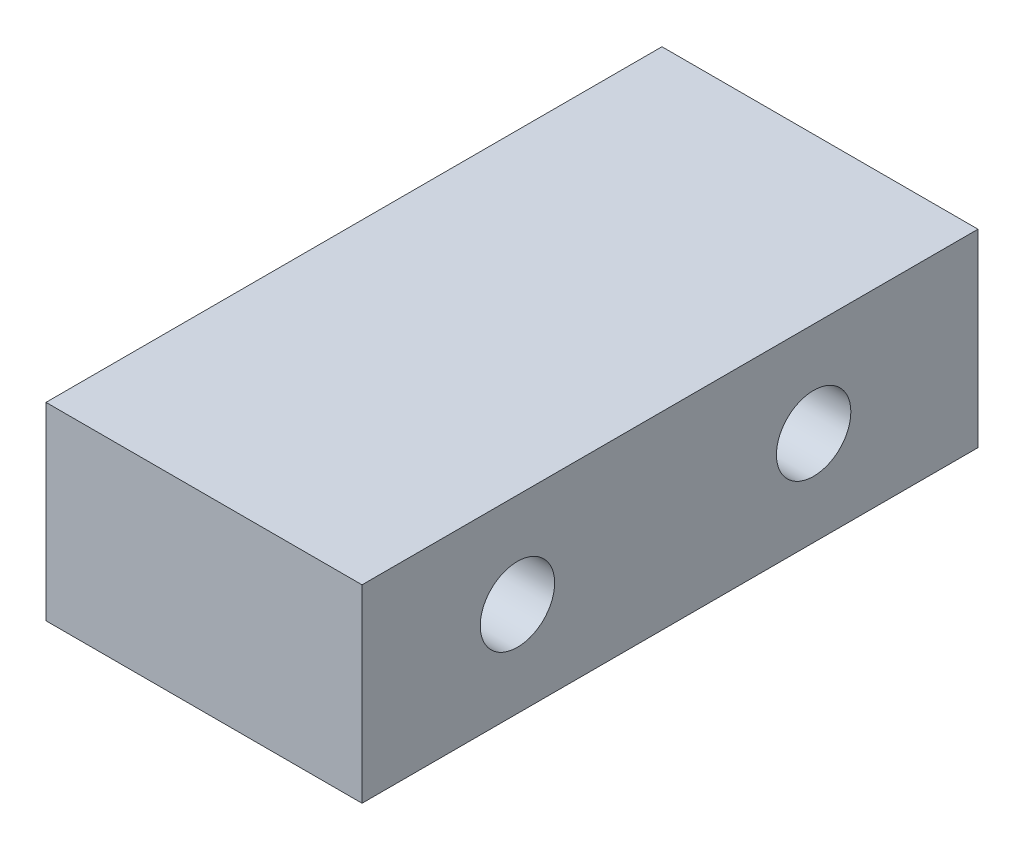
from build123d import *

# Parameters (mm, degrees)
SKETCH1_W           = 10.19
SKETCH1_H           = 19.86
BOSS_EXTRUDE1_DEPTH = 6.1
SKETCH2_R           = 1.2
CUT_EXTRUDE1_DEPTH  = 16.48066536


with BuildPart() as part:
    # Sketch1 → Boss-Extrude1 (new body)
    with BuildSketch(Plane(origin=(0, 0, 0), x_dir=(1, 0, 0), z_dir=(0, 1, 0))):
        Rectangle(SKETCH1_W, SKETCH1_H)
    extrude(amount=BOSS_EXTRUDE1_DEPTH)

    # Sketch2 → Cut-Extrude1 (cut, through all)
    with BuildSketch(Plane(origin=(5.095, 0, 0), x_dir=(0, 0, -1), z_dir=(1, 0, 0))):
        with Locations((4.63, 3.05)):
            Circle(SKETCH2_R)
        with Locations((-4.92, 3.05)):
            Circle(SKETCH2_R)
    extrude(amount=-CUT_EXTRUDE1_DEPTH, mode=Mode.SUBTRACT)


solid = part.part
